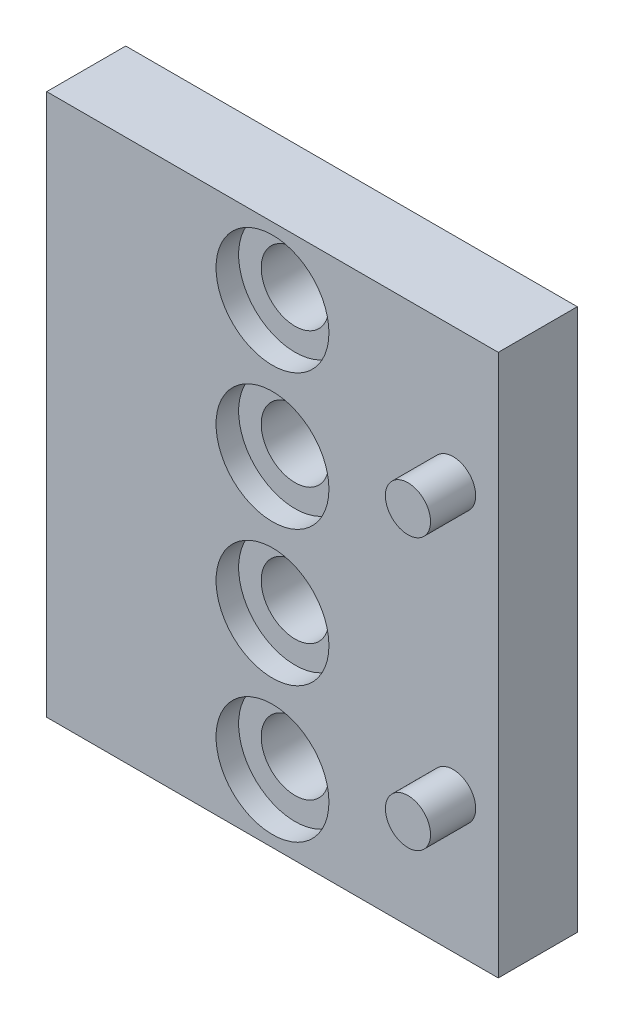
from build123d import *

# Parameters (mm, degrees)
SKETCH1_W           = 20
SKETCH1_H           = 24
BOSS_EXTRUDE1_DEPTH = 3.5
SKETCH2_W           = 16
SKETCH2_H           = 22
CUT_EXTRUDE1_DEPTH  = 0.4
SKETCH3_R           = 1.5
CUT_EXTRUDE2_DEPTH  = 17.007810594
SKETCH4_R           = 2.5
CUT_EXTRUDE3_DEPTH  = 1
SKETCH5_R           = 1
BOSS_EXTRUDE2_DEPTH = 2


with BuildPart() as part:
    # Sketch1 → Boss-Extrude1 (new body)
    with BuildSketch(Plane.XY):
        Rectangle(SKETCH1_W, SKETCH1_H)
    extrude(amount=BOSS_EXTRUDE1_DEPTH)

    # Sketch2 → Cut-Extrude1 (cut)
    with BuildSketch(Plane(origin=(0, 0, 0), x_dir=(-1, 0, 0), z_dir=(0, 0, -1))):
        Rectangle(SKETCH2_W, SKETCH2_H)
    extrude(amount=-CUT_EXTRUDE1_DEPTH, mode=Mode.SUBTRACT)

    # Sketch3 → Cut-Extrude2 (cut, through all)
    with BuildSketch(Plane.XY.offset(3.5)):
        with Locations((0, 3)):
            Circle(SKETCH3_R)
        with Locations((0, 9)):
            Circle(SKETCH3_R)
        with Locations(Location((0, -9, 0), (0, 0, 180))):
            Circle(SKETCH3_R)
        with Locations(Location((0, -3, 0), (0, 0, 180))):
            Circle(SKETCH3_R)
    extrude(amount=-CUT_EXTRUDE2_DEPTH, mode=Mode.SUBTRACT)

    # Sketch4 → Cut-Extrude3 (cut)
    with BuildSketch(Plane.XY.offset(3.5)):
        with Locations((0, 9)):
            Circle(SKETCH4_R)
    cut_extrude3 = extrude(amount=-CUT_EXTRUDE3_DEPTH, mode=Mode.SUBTRACT)

    # Sketch-Pattern1: Cut-Extrude3 at 3 more places
    with Locations((0, -6, 0), (0, -12, 0), (0, -18, 0)):
        add(cut_extrude3, mode=Mode.SUBTRACT)

    # Sketch5 → Boss-Extrude2 (add)
    with BuildSketch(Plane.XY.offset(3.5)):
        with Locations((8, 6)):
            Circle(SKETCH5_R)
        with Locations(Location((8, -6, 0), (0, 0, 180))):
            Circle(SKETCH5_R)
    extrude(amount=BOSS_EXTRUDE2_DEPTH)


solid = part.part
